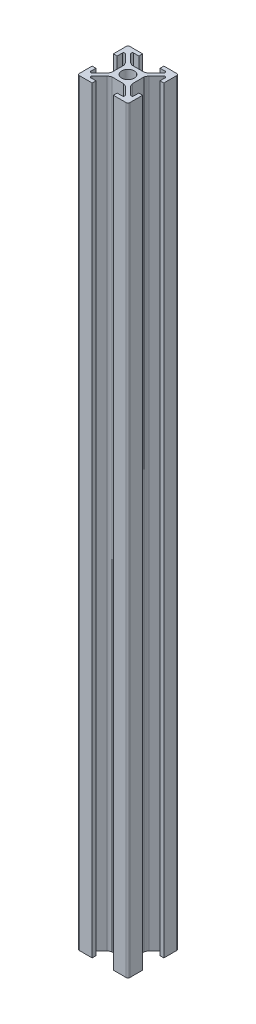
from build123d import *

# Parameters (mm, degrees)
SKETCH1_R           = 2.5
BOSS_EXTRUDE1_DEPTH = 300


with BuildPart() as part:
    # Sketch1 → Boss-Extrude1 (new body)
    with BuildSketch(Plane(origin=(0, 0, 0), x_dir=(1, 0, 0), z_dir=(0, 1, 0))):
        with BuildLine():
            Line((-3.610984523, 4.671644695), (-6.585786438, 7.646446609))
            ThreePointArc((-6.585786438, 7.646446609), (-6.694172813, 8.191341716), (-6.232233047, 8.5))
            Line((-6.232233047, 8.5), (-4.2, 8.5))
            Line((-4.2, 8.5), (-4.2, 10))
            Line((-4.2, 10), (-9.25, 10))
            ThreePointArc((-9.25, 10), (-9.780330086, 9.780330086), (-10, 9.25))
            Line((-10, 9.25), (-10, 4.2))
            Line((-10, 4.2), (-8.5, 4.2))
            Line((-8.5, 4.2), (-8.5, 6.232233047))
            ThreePointArc((-8.5, 6.232233047), (-8.191341716, 6.694172813), (-7.646446609, 6.585786438))
            Line((-7.646446609, 6.585786438), (-4.671644695, 3.610984523))
            ThreePointArc((-4.671644695, 3.610984523), (-4.244383234, 2.985253206), (-4, 2.268058063))
            Line((-4, 2.268058063), (-4, -2.268058063))
            ThreePointArc((-4, -2.268058063), (-4.244383234, -2.985253206), (-4.671644695, -3.610984523))
            Line((-4.671644695, -3.610984523), (-7.646446609, -6.585786438))
            ThreePointArc((-7.646446609, -6.585786438), (-8.191341716, -6.694172813), (-8.5, -6.232233047))
            Line((-8.5, -6.232233047), (-8.5, -4.2))
            Line((-8.5, -4.2), (-10, -4.2))
            Line((-10, -4.2), (-10, -9.25))
            ThreePointArc((-10, -9.25), (-9.780330086, -9.780330086), (-9.25, -10))
            Line((-9.25, -10), (-4.2, -10))
            Line((-4.2, -10), (-4.2, -8.5))
            Line((-4.2, -8.5), (-6.232233047, -8.5))
            ThreePointArc((-6.232233047, -8.5), (-6.694172813, -8.191341716), (-6.585786438, -7.646446609))
            Line((-6.585786438, -7.646446609), (-3.610984523, -4.671644695))
            ThreePointArc((-3.610984523, -4.671644695), (-2.985253206, -4.244383234), (-2.268058063, -4))
            Line((-2.268058063, -4), (2.268058063, -4))
            ThreePointArc((2.268058063, -4), (2.985253206, -4.244383234), (3.610984523, -4.671644695))
            Line((3.610984523, -4.671644695), (6.585786438, -7.646446609))
            ThreePointArc((6.585786438, -7.646446609), (6.694172813, -8.191341716), (6.232233047, -8.5))
            Line((6.232233047, -8.5), (4.2, -8.5))
            Line((4.2, -8.5), (4.2, -10))
            Line((4.2, -10), (9.25, -10))
            ThreePointArc((9.25, -10), (9.780330086, -9.780330086), (10, -9.25))
            Line((10, -9.25), (10, -4.2))
            Line((10, -4.2), (8.5, -4.2))
            Line((8.5, -4.2), (8.5, -6.232233047))
            ThreePointArc((8.5, -6.232233047), (8.191341716, -6.694172813), (7.646446609, -6.585786438))
            Line((7.646446609, -6.585786438), (4.671644695, -3.610984523))
            ThreePointArc((4.671644695, -3.610984523), (4.244383234, -2.985253206), (4, -2.268058063))
            Line((4, -2.268058063), (4, 2.268058063))
            ThreePointArc((4, 2.268058063), (4.244383234, 2.985253206), (4.671644695, 3.610984523))
            Line((4.671644695, 3.610984523), (7.646446609, 6.585786438))
            ThreePointArc((7.646446609, 6.585786438), (8.191341716, 6.694172813), (8.5, 6.232233047))
            Line((8.5, 6.232233047), (8.5, 4.2))
            Line((8.5, 4.2), (10, 4.2))
            Line((10, 4.2), (10, 9.25))
            ThreePointArc((10, 9.25), (9.780330086, 9.780330086), (9.25, 10))
            Line((9.25, 10), (4.2, 10))
            Line((4.2, 10), (4.2, 8.5))
            Line((4.2, 8.5), (6.232233047, 8.5))
            ThreePointArc((6.232233047, 8.5), (6.694172813, 8.191341716), (6.585786438, 7.646446609))
            Line((6.585786438, 7.646446609), (3.610984523, 4.671644695))
            ThreePointArc((3.610984523, 4.671644695), (2.985253206, 4.244383234), (2.268058063, 4))
            Line((2.268058063, 4), (-2.268058063, 4))
            ThreePointArc((-2.268058063, 4), (-2.985253206, 4.244383234), (-3.610984523, 4.671644695))
        make_face()
        with Locations(Location((0, 0, 0), (0, 0, 270))):
            Circle(SKETCH1_R, mode=Mode.SUBTRACT)
    extrude(amount=BOSS_EXTRUDE1_DEPTH)


solid = part.part
